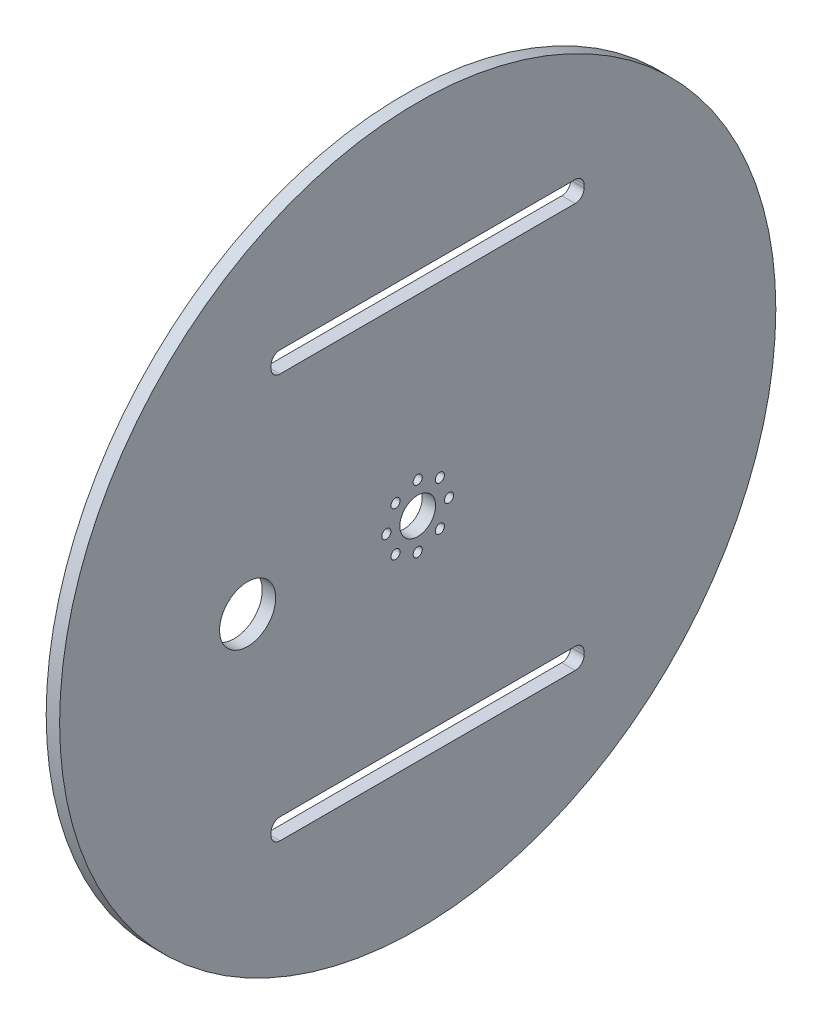
from build123d import *

# Parameters (mm, degrees)
SKETCH_1_R      = 80
SKETCH_1_R_2    = 4
SKETCH_1_R_3    = 1.02
SKETCH_1_R_4    = 6.269952148
EXTRUDE_1_DEPTH = 3


with BuildPart() as part:
    # ｽｹｯﾁ1 → ﾎﾞｽ - 押し出し1 (new body)
    with BuildSketch(Plane(origin=(0, 0, 0), x_dir=(0, 0, -1), z_dir=(1, 0, 0))):
        Circle(SKETCH_1_R)
        Circle(SKETCH_1_R_2, mode=Mode.SUBTRACT)
        with Locations((4.949747468, 4.949747468)):
            Circle(SKETCH_1_R_3, mode=Mode.SUBTRACT)
        with Locations((7, 0)):
            Circle(SKETCH_1_R_3, mode=Mode.SUBTRACT)
        with Locations((4.949747468, -4.949747468)):
            Circle(SKETCH_1_R_3, mode=Mode.SUBTRACT)
        with Locations((0, -7)):
            Circle(SKETCH_1_R_3, mode=Mode.SUBTRACT)
        with Locations((-4.949747468, -4.949747468)):
            Circle(SKETCH_1_R_3, mode=Mode.SUBTRACT)
        with Locations((-7, 0)):
            Circle(SKETCH_1_R_3, mode=Mode.SUBTRACT)
        with Locations((-4.949747468, 4.949747468)):
            Circle(SKETCH_1_R_3, mode=Mode.SUBTRACT)
        with Locations((0, 7)):
            Circle(SKETCH_1_R_3, mode=Mode.SUBTRACT)
        with Locations((-38, 0)):
            Circle(SKETCH_1_R_4, mode=Mode.SUBTRACT)
        with BuildLine():
            Line((-30.755353243, 42.837057437), (35.175005572, 42.837057437))
            ThreePointArc((35.175005572, 42.837057437), (36.589219135, 43.422843874), (37.175005572, 44.837057437))
            Line((37.175005572, 44.837057437), (37.175005572, 45.489077015))
            ThreePointArc((37.175005572, 45.489077015), (36.589219135, 46.903290577), (35.175005572, 47.489077015))
            Line((35.175005572, 47.489077015), (-30.755353243, 47.489077015))
            ThreePointArc((-30.755353243, 47.489077015), (-32.169566806, 46.903290577), (-32.755353243, 45.489077015))
            Line((-32.755353243, 45.489077015), (-32.755353243, 44.837057437))
            ThreePointArc((-32.755353243, 44.837057437), (-32.169566806, 43.422843874), (-30.755353243, 42.837057437))
        make_face(mode=Mode.SUBTRACT)
        with BuildLine():
            Line((37.175005572, -45.489077015), (37.175005572, -44.837057437))
            ThreePointArc((37.175005572, -44.837057437), (36.589219135, -43.422843874), (35.175005572, -42.837057437))
            Line((35.175005572, -42.837057437), (-30.755353243, -42.837057437))
            ThreePointArc((-30.755353243, -42.837057437), (-32.169566806, -43.422843874), (-32.755353243, -44.837057437))
            Line((-32.755353243, -44.837057437), (-32.755353243, -45.489077015))
            ThreePointArc((-32.755353243, -45.489077015), (-32.169566806, -46.903290577), (-30.755353243, -47.489077015))
            Line((-30.755353243, -47.489077015), (35.175005572, -47.489077015))
            ThreePointArc((35.175005572, -47.489077015), (36.589219135, -46.903290577), (37.175005572, -45.489077015))
        make_face(mode=Mode.SUBTRACT)
    extrude(amount=EXTRUDE_1_DEPTH)


solid = part.part
